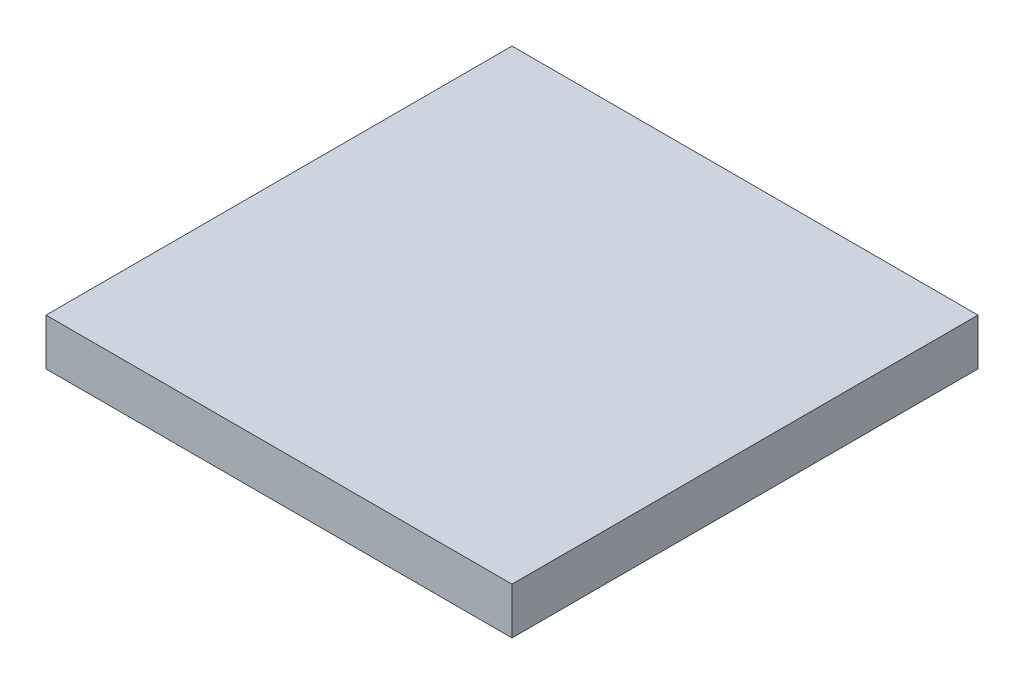
from build123d import *

# Parameters (mm, degrees)
SKETCH_1_W         = 10
SKETCH_1_H         = 1
THIN_0_0_001_DEPTH = 10


with BuildPart() as part:
    # 草图1 → Thin_0_0.001 (new body)
    with BuildSketch(Plane.XY):
        with Locations((0, -0.5)):
            Rectangle(SKETCH_1_W, SKETCH_1_H)
    extrude(amount=THIN_0_0_001_DEPTH)


solid = part.part
